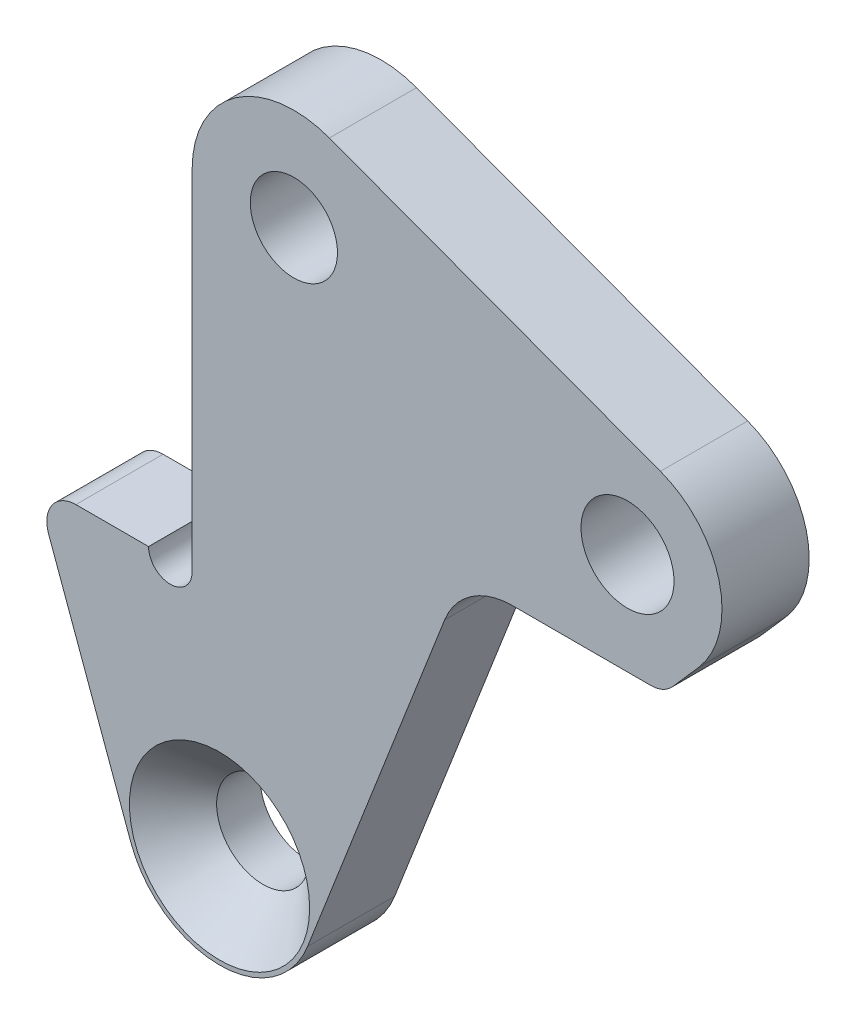
from build123d import *

# Parameters (mm, degrees)
SKETCH_1_R          = 1.5
SKETCH_1_R_2        = 1.6
EXTRUDE_1_DEPTH     = 1.5
CHAMFER_1_SIZE      = 1.5
SKETCH_2_R          = 0.75
CUT_EXTRUDE_1_DEPTH = 28.684874976
CUT_EXTRUDE_2_DEPTH = 28.684874976
FILLET_1_R          = 2.5
FILLET_2_R          = 1


with BuildPart() as part:
    # 草图1 → 凸台-拉伸1 (new, symmetric)
    with BuildSketch(Plane.XY):
        with BuildLine():
            Line((-7.5, -12), (-3.5, -12))
            Line((-3.5, -12), (-3.5, 0))
            ThreePointArc((-3.5, 0), (-1.997674375, 2.873899283), (1.219598337, 3.280637117))
            Line((1.219598337, 3.280637117), (12.609663209, -0.953694105))
            ThreePointArc((12.609663209, -0.953694105), (14.628222296, -3.204119106), (13.92040375, -6.143164253))
            Line((13.92040375, -6.143164253), (-0.114583662, -22.143164253))
            ThreePointArc((-0.114583662, -22.143164253), (-3.157233879, -23.194243112), (-5.61180939, -21.111565466))
            Line((-5.61180939, -21.111565466), (-8.439692621, -13.342020143))
            ThreePointArc((-8.439692621, -13.342020143), (-8.319152044, -12.426423564), (-7.5, -12))
        make_face()
        Circle(SKETCH_1_R, mode=Mode.SUBTRACT)
        with Locations((-2.557808372, -20)):
            Circle(SKETCH_1_R_2, mode=Mode.SUBTRACT)
        with Locations((11.477179039, -4)):
            Circle(SKETCH_1_R_2, mode=Mode.SUBTRACT)
    extrude(amount=EXTRUDE_1_DEPTH, both=True)

    # 倒角1
    chamfer_1_edges = [part.edges().sort_by_distance(p)[0] for p in [
        (-4.157808372, -20, 1.5),
    ]]
    chamfer(chamfer_1_edges, length=CHAMFER_1_SIZE)

    # 草图2 → 切除-拉伸1 (cut, through all)
    with BuildSketch(Plane.XY.offset(1.5)):
        with Locations((-4.25, -12)):
            Circle(SKETCH_2_R)
    extrude(amount=-CUT_EXTRUDE_1_DEPTH, mode=Mode.SUBTRACT)

    # 草图3 → 切除-拉伸2 (cut, through all)
    with BuildSketch(Plane.XY.offset(1.5)):
        with BuildLine():
            Line((5.807426852, -7.5), (12.73020546, -7.5))
            Line((12.73020546, -7.5), (-0.114583662, -22.143164253))
            ThreePointArc((-0.114583662, -22.143164253), (0.219636548, -21.687690646), (0.469932731, -21.181221322))
            Line((0.469932731, -21.181221322), (5.807426852, -7.5))
        make_face()
    extrude(amount=-CUT_EXTRUDE_2_DEPTH, mode=Mode.SUBTRACT)

    # 圆角1
    fillet_1_edges = [part.edges().sort_by_distance(p)[0] for p in [
        (5.807426852, -7.5, 0),
    ]]
    fillet(fillet_1_edges, radius=FILLET_1_R)

    # 圆角2
    fillet_2_edges = [part.edges().sort_by_distance(p)[0] for p in [
        (12.73020546, -7.5, 0),
    ]]
    fillet(fillet_2_edges, radius=FILLET_2_R)


solid = part.part
